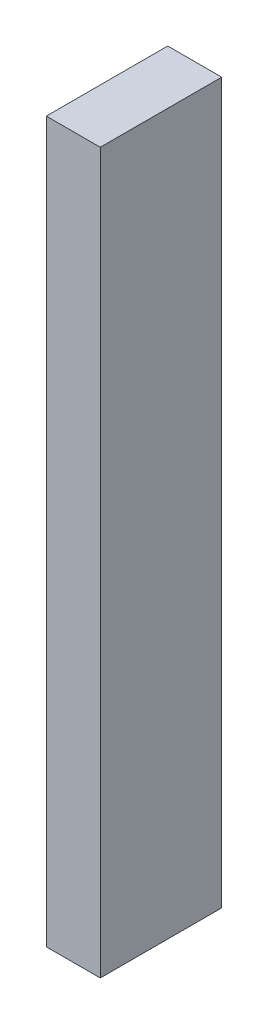
from build123d import *

# Parameters (mm, degrees)
PROFILE_SKETCH_W      = 6
PROFILE_SKETCH_H      = 13.5
PROFILE_EXTRUDE_DEPTH = 80


with BuildPart() as part:
    # Profile Sketch → Profile Extrude (new body)
    with BuildSketch(Plane(origin=(-13.83405858, 0, -105.75669297), x_dir=(-1, 0, 0), z_dir=(0, 1, 0))):
        with Locations((0, 6.75)):
            Rectangle(PROFILE_SKETCH_W, PROFILE_SKETCH_H)
    extrude(amount=PROFILE_EXTRUDE_DEPTH)


solid = part.part
